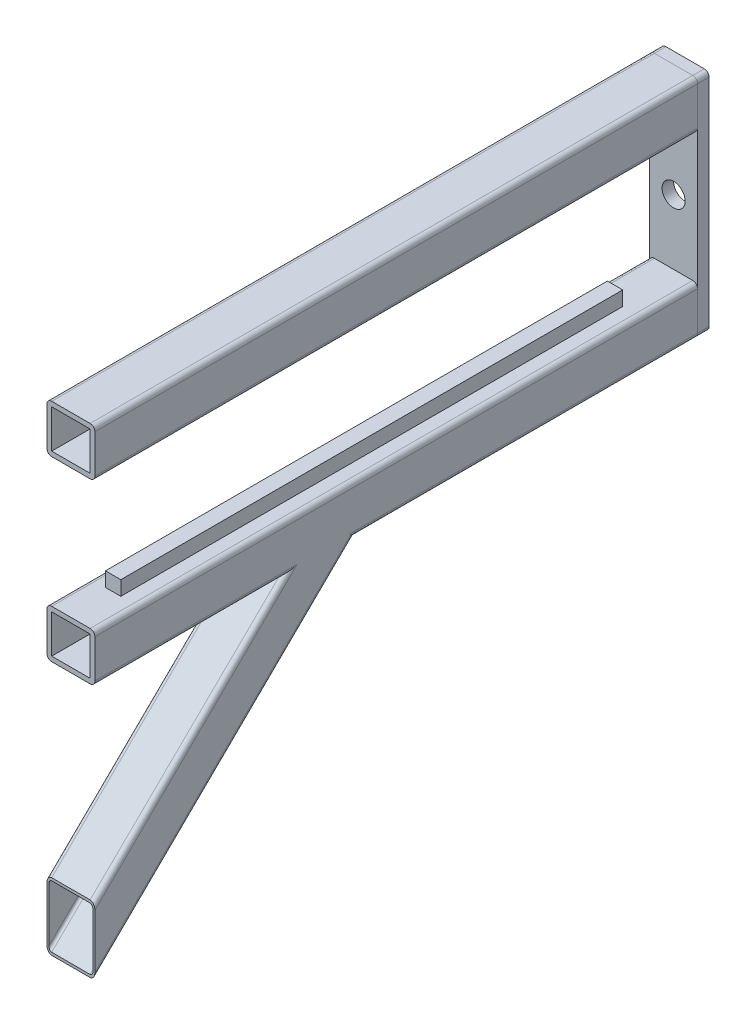
from build123d import *

# Parameters (mm, degrees)
SKETCH1_W             = 40
SKETCH1_H             = 40
BOSS_EXTRUDE1_DEPTH   = 628
BOSS_EXTRUDE1_2_DEPTH = 628
SKETCH2_R             = 6.25
SKETCH2_R_2           = 12
BOSS_EXTRUDE2_DEPTH   = 12
BOSS_EXTRUDE4_START   = -45
SKETCH3_W             = 16
SKETCH3_H             = 15
BOSS_EXTRUDE4_DEPTH   = 523
BOSS_EXTRUDE4_2_DEPTH = 523
SKETCH6_W             = 683.204916826
SKETCH6_H             = 1233.314066904
CUT_EXTRUDE1_DEPTH    = 849.720942988


with BuildPart() as part:
    # Sketch1 → Boss-Extrude1 (new body)
    with BuildSketch(Plane.XY):
        with BuildLine():
            Line((-20, -25), (20, -25))
            ThreePointArc((20, -25), (23.535533906, -23.535533906), (25, -20))
            Line((25, -20), (25, 20))
            ThreePointArc((25, 20), (23.535533906, 23.535533906), (20, 25))
            Line((20, 25), (-20, 25))
            ThreePointArc((-20, 25), (-23.535533906, 23.535533906), (-25, 20))
            Line((-25, 20), (-25, -20))
            ThreePointArc((-25, -20), (-23.535533906, -23.535533906), (-20, -25))
        make_face()
        Rectangle(SKETCH1_W, SKETCH1_H, mode=Mode.SUBTRACT)
    extrude(amount=BOSS_EXTRUDE1_DEPTH)


with BuildPart() as body_2:
    # Sketch1 → Boss-Extrude1 2 (new body)
    with BuildSketch(Plane.XY):
        with BuildLine():
            Line((-20, -210), (20, -210))
            ThreePointArc((20, -210), (23.535533906, -208.535533906), (25, -205))
            Line((25, -205), (25, -165))
            ThreePointArc((25, -165), (23.535533906, -161.464466094), (20, -160))
            Line((20, -160), (-20, -160))
            ThreePointArc((-20, -160), (-23.535533906, -161.464466094), (-25, -165))
            Line((-25, -165), (-25, -205))
            ThreePointArc((-25, -205), (-23.535533906, -208.535533906), (-20, -210))
        make_face()
        with Locations((0, -185)):
            Rectangle(SKETCH1_W, SKETCH1_H, mode=Mode.SUBTRACT)
    extrude(amount=BOSS_EXTRUDE1_2_DEPTH)

    # Sweep1: sweep along a path in Sketch4
    with BuildLine(Plane(origin=(0, 0, 0), x_dir=(0, 0, -1), z_dir=(1, 0, 0))) as sweep1_path:
        Line((-711.412925919, -556.868242106), (-358, -210))
    # Sketch5 → Sweep1 (sweep)
    with BuildSketch(Plane(origin=(0, -210, 358), x_dir=(-1, 0, 0), z_dir=(0, 0.7004677164823951, -0.7136840884914969))):
        with BuildLine():
            Line((20, 0), (-20, 0))
            ThreePointArc((-20, 0), (-23.535533906, 1.464466094), (-25, 5))
            Line((-25, 5), (-25, 45))
            ThreePointArc((-25, 45), (-23.535533906, 48.535533906), (-20, 50))
            Line((-20, 50), (20, 50))
            ThreePointArc((20, 50), (23.535533906, 48.535533906), (25, 45))
            Line((25, 45), (25, 5))
            ThreePointArc((25, 5), (23.535533906, 1.464466094), (20, 0))
        make_face()
        with BuildLine():
            Line((20, 2), (-20, 2))
            ThreePointArc((-20, 2), (-22.121320344, 2.878679656), (-23, 5))
            Line((-23, 5), (-23, 45))
            ThreePointArc((-23, 45), (-22.121320344, 47.121320344), (-20, 48))
            Line((-20, 48), (20, 48))
            ThreePointArc((20, 48), (22.121320344, 47.121320344), (23, 45))
            Line((23, 45), (23, 5))
            ThreePointArc((23, 5), (22.121320344, 2.878679656), (20, 2))
        make_face(mode=Mode.SUBTRACT)
    sweep(path=sweep1_path.line)

    # Sketch6 → Cut-Extrude1 (cut, through all)
    with BuildSketch(Plane.XY.offset(628)):
        Rectangle(SKETCH6_W, SKETCH6_H)
    extrude(amount=CUT_EXTRUDE1_DEPTH, mode=Mode.SUBTRACT)


with BuildPart() as body_3:
    # Sketch2 → Boss-Extrude2 (new body)
    with BuildSketch(Plane.XY):
        with BuildLine():
            Line((25, -205), (25, -165))
            Line((25, -165), (25, -20))
            Line((25, -20), (25, 20))
            ThreePointArc((25, 20), (23.535533906, 23.535533906), (20, 25))
            Line((20, 25), (-20, 25))
            ThreePointArc((-20, 25), (-23.535533906, 23.535533906), (-25, 20))
            Line((-25, 20), (-25, -20))
            Line((-25, -20), (-25, -165))
            Line((-25, -165), (-25, -205))
            ThreePointArc((-25, -205), (-23.535533906, -208.535533906), (-20, -210))
            Line((-20, -210), (20, -210))
            ThreePointArc((20, -210), (23.535533906, -208.535533906), (25, -205))
        make_face()
        Circle(SKETCH2_R, mode=Mode.SUBTRACT)
        with Locations((0, -185)):
            Circle(SKETCH2_R, mode=Mode.SUBTRACT)
        with Locations((0, -92.5)):
            Circle(SKETCH2_R_2, mode=Mode.SUBTRACT)
    extrude(amount=-BOSS_EXTRUDE2_DEPTH)


with BuildPart() as body_4:
    # Sketch3 → Boss-Extrude4 (new body)
    with BuildSketch(Plane.XY.offset(628).offset(BOSS_EXTRUDE4_START)):
        with Locations((-1, -32.5)):
            Rectangle(SKETCH3_W, SKETCH3_H)
    extrude(amount=-BOSS_EXTRUDE4_DEPTH)


with BuildPart() as body_5:
    # Sketch3 → Boss-Extrude4 2 (new body)
    with BuildSketch(Plane.XY.offset(628).offset(BOSS_EXTRUDE4_START)):
        with Locations((-1, -152.5)):
            Rectangle(SKETCH3_W, SKETCH3_H)
    extrude(amount=-BOSS_EXTRUDE4_2_DEPTH)


solid = Compound([part.part, body_2.part, body_3.part, body_4.part, body_5.part])
